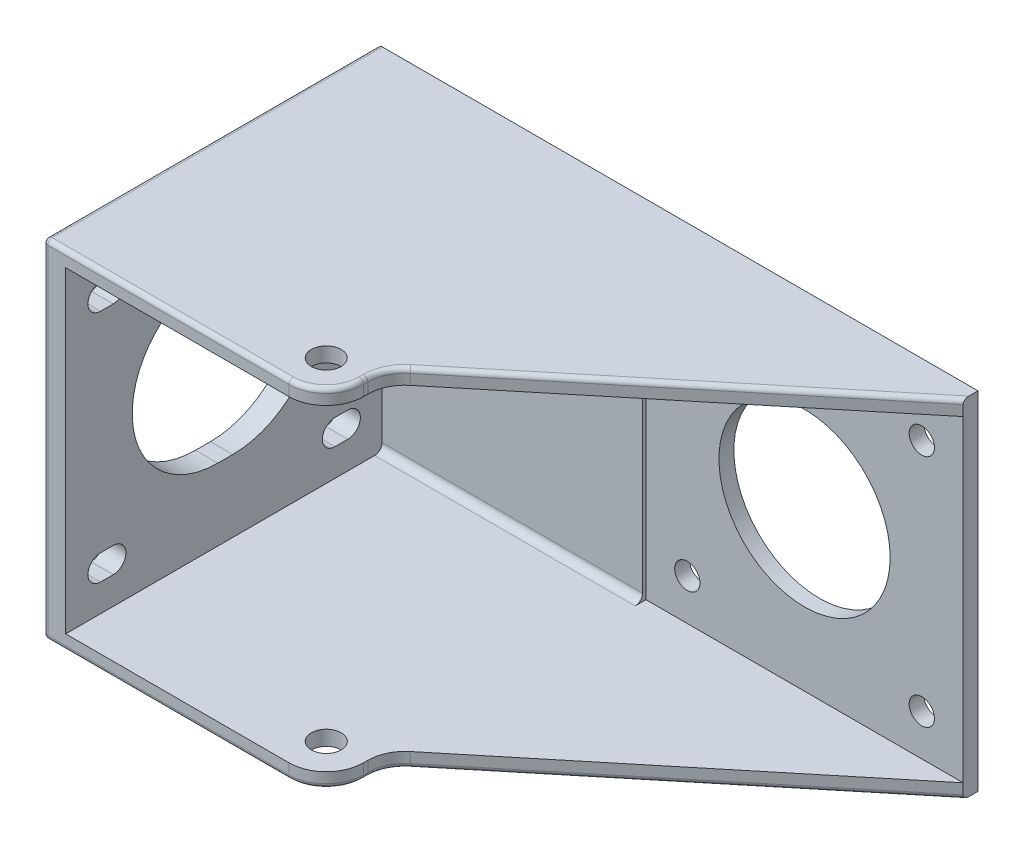
from build123d import *

# Parameters (mm, degrees)
SKETCH_1_W               = 42.6
SKETCH_1_H               = 42.6
SKETCH_1_R               = 1.7
SKETCH_1_R_2             = 11.5
EXTRUDE_1_DEPTH          = 2
SKETCH_2_W               = 37
SKETCH_2_H               = 42.6
EXTRUDE_2_DEPTH          = 2
EXTRUDE_3_DEPTH          = 2
EXTRUDE_4_DEPTH          = 2
BOSS_EXTRUDE1_DEPTH      = 36
BOSS_EXTRUDE1_DEPTH_BACK = 2
SKETCH1_W                = 44.957073211
SKETCH1_H                = 46.6
SKETCH4_W                = 35
SKETCH4_H                = 42.6
CUT_EXTRUDE2_DEPTH       = 42.5
CUT_EXTRUDE3_REACH       = 97.186
CUT_EXTRUDE4_REACH       = 79.978
SKETCH6_R                = 1.7
SKETCH7_R                = 3
CUT_EXTRUDE5_DEPTH       = 1.5
FILLET1_R                = 5
FILLET2_R                = 1
CHAMFER1_SIZE            = 1
FILLET3_R                = 0.6
SKETCH8_R                = 2
CUT_EXTRUDE6_DEPTH       = 88.801984213


with BuildPart() as part:
    # Эскиз1 → Бобышка-Вытянуть1 (new body)
    with BuildSketch(Plane.XY):
        Rectangle(SKETCH_1_W, SKETCH_1_H)
        with Locations((-15.75, 15.75)):
            Circle(SKETCH_1_R, mode=Mode.SUBTRACT)
        with Locations((15.75, 15.75)):
            Circle(SKETCH_1_R, mode=Mode.SUBTRACT)
        with Locations((15.75, -15.75)):
            Circle(SKETCH_1_R, mode=Mode.SUBTRACT)
        with Locations((-15.75, -15.75)):
            Circle(SKETCH_1_R, mode=Mode.SUBTRACT)
        Circle(SKETCH_1_R_2, mode=Mode.SUBTRACT)
    extrude(amount=EXTRUDE_1_DEPTH)

    # Эскиз2 → Бобышка-Вытянуть2 (add)
    with BuildSketch(Plane.ZY.offset(21.3)):
        with Locations((18.5, 0)):
            Rectangle(SKETCH_2_W, SKETCH_2_H)
    extrude(amount=EXTRUDE_2_DEPTH)

    # Эскиз3 → Бобышка-Вытянуть3 (add)
    with BuildSketch(Plane.XZ.offset(21.3)):
        Polygon((-23.3, 0), (-23.3, 37), (-21.3, 37), (21.3, 2), (21.3, 0), align=None)
    extrude(amount=EXTRUDE_3_DEPTH)

    # Эскиз4 → Бобышка-Вытянуть4 (add)
    with BuildSketch(Plane(origin=(0, 21.3, 0), x_dir=(1, 0, 0), z_dir=(0, 1, 0))):
        Polygon((-23.3, -37), (-23.3, 0), (21.3, 0), (21.3, -2), (-21.3, -37), align=None)
    extrude(amount=EXTRUDE_4_DEPTH)

    # Sketch1 → Boss-Extrude1 (add, two sides: drawn at the far end of the back side and taken through both)
    with BuildSketch(Plane.ZY.offset(23.3).offset(-BOSS_EXTRUDE1_DEPTH_BACK)):
        with Locations((22.478536606, 0)):
            Rectangle(SKETCH1_W, SKETCH1_H)
    extrude(amount=BOSS_EXTRUDE1_DEPTH + BOSS_EXTRUDE1_DEPTH_BACK)

    # Sketch4 → Cut-Extrude2 (cut)
    with BuildSketch(Plane.XY.offset(44.957073211)):
        with Locations((-38.8, 0)):
            Rectangle(SKETCH4_W, SKETCH4_H)
    extrude(amount=-CUT_EXTRUDE2_DEPTH, mode=Mode.SUBTRACT)

    # Sketch5 → Cut-Extrude3 (cut, up to next)
    with BuildSketch(Plane.ZY.offset(59.3), mode=Mode.PRIVATE) as cut_extrude3_sk1:
        with BuildLine():
            Line((38.570845355, -14.202343453), (40.270845355, -14.202343453))
            ThreePointArc((40.270845355, -14.202343453), (41.970845355, -15.902343453), (40.270845355, -17.602343453))
            Line((40.270845355, -17.602343453), (38.570845355, -17.602343453))
            ThreePointArc((38.570845355, -17.602343453), (36.870845355, -15.902343453), (38.570845355, -14.202343453))
        make_face()
    cut_extrude3_tool1 = extrude(cut_extrude3_sk1.sketch, amount=-CUT_EXTRUDE3_REACH, mode=Mode.PRIVATE) & part.part
    # Sketch5 → Cut-Extrude3 (cut, up to next)
    with BuildSketch(Plane.ZY.offset(59.3), mode=Mode.PRIVATE) as cut_extrude3_sk2:
        with BuildLine():
            Line((38.570845355, 13.897656547), (40.270845355, 13.897656547))
            ThreePointArc((40.270845355, 13.897656547), (41.970845355, 15.597656547), (40.270845355, 17.297656547))
            Line((40.270845355, 17.297656547), (38.570845355, 17.297656547))
            ThreePointArc((38.570845355, 17.297656547), (36.870845355, 15.597656547), (38.570845355, 13.897656547))
        make_face()
    cut_extrude3_tool2 = extrude(cut_extrude3_sk2.sketch, amount=-CUT_EXTRUDE3_REACH, mode=Mode.PRIVATE) & part.part
    # Sketch5 → Cut-Extrude3 (cut, up to next)
    with BuildSketch(Plane.ZY.offset(59.3), mode=Mode.PRIVATE) as cut_extrude3_sk3:
        with BuildLine():
            Line((7.070845355, 17.297656547), (8.770845355, 17.297656547))
            ThreePointArc((8.770845355, 17.297656547), (10.470845355, 15.597656547), (8.770845355, 13.897656547))
            Line((8.770845355, 13.897656547), (7.070845355, 13.897656547))
            ThreePointArc((7.070845355, 13.897656547), (5.370845355, 15.597656547), (7.070845355, 17.297656547))
        make_face()
    cut_extrude3_tool3 = extrude(cut_extrude3_sk3.sketch, amount=-CUT_EXTRUDE3_REACH, mode=Mode.PRIVATE) & part.part
    # Sketch5 → Cut-Extrude3 (cut, up to next)
    with BuildSketch(Plane.ZY.offset(59.3), mode=Mode.PRIVATE) as cut_extrude3_sk4:
        with BuildLine():
            Line((7.070845355, -14.202343453), (8.770845355, -14.202343453))
            ThreePointArc((8.770845355, -14.202343453), (10.470845355, -15.902343453), (8.770845355, -17.602343453))
            Line((8.770845355, -17.602343453), (7.070845355, -17.602343453))
            ThreePointArc((7.070845355, -17.602343453), (5.370845355, -15.902343453), (7.070845355, -14.202343453))
        make_face()
    cut_extrude3_tool4 = extrude(cut_extrude3_sk4.sketch, amount=-CUT_EXTRUDE3_REACH, mode=Mode.PRIVATE) & part.part
    # Sketch5 → Cut-Extrude3 (cut, up to next)
    with BuildSketch(Plane.ZY.offset(59.3), mode=Mode.PRIVATE) as cut_extrude3_sk5:
        with BuildLine():
            Line((22.520845355, 11.347656547), (24.520845355, 11.347656547))
            ThreePointArc((24.520845355, 11.347656547), (36.020845355, -0.152343453), (24.520845355, -11.652343453))
            Line((24.520845355, -11.652343453), (22.520845355, -11.652343453))
            ThreePointArc((22.520845355, -11.652343453), (11.020845355, -0.152343453), (22.520845355, 11.347656547))
        make_face()
    cut_extrude3_tool5 = extrude(cut_extrude3_sk5.sketch, amount=-CUT_EXTRUDE3_REACH, mode=Mode.PRIVATE) & part.part
    add(cut_extrude3_tool1.solids().sort_by_distance((-59.3, -15.902343, 39.420845))[0], mode=Mode.SUBTRACT)
    add(cut_extrude3_tool2.solids().sort_by_distance((-59.3, 15.597657, 39.420845))[0], mode=Mode.SUBTRACT)
    add(cut_extrude3_tool3.solids().sort_by_distance((-59.3, 15.597657, 7.920845))[0], mode=Mode.SUBTRACT)
    add(cut_extrude3_tool4.solids().sort_by_distance((-59.3, -15.902343, 7.920845))[0], mode=Mode.SUBTRACT)
    add(cut_extrude3_tool5.solids().sort_by_distance((-59.3, -0.152343, 23.520845))[0], mode=Mode.SUBTRACT)

    # Sketch6 → Cut-Extrude4 (cut, up to next)
    with BuildSketch(Plane(origin=(0, 0, 0), x_dir=(-1, 0, 0), z_dir=(0, 0, -1)), mode=Mode.PRIVATE) as cut_extrude4_sk1:
        with Locations((37.3, 0)):
            Circle(SKETCH6_R)
    cut_extrude4_tool1 = extrude(cut_extrude4_sk1.sketch, amount=-CUT_EXTRUDE4_REACH, mode=Mode.PRIVATE) & part.part
    add(cut_extrude4_tool1.solids().sort_by_distance((-37.3, 0, 0))[0], mode=Mode.SUBTRACT)

    # Sketch7 → Cut-Extrude5 (cut)
    with BuildSketch(Plane.XY.offset(2.457073211)):
        with Locations((-37.3, 0)):
            Circle(SKETCH7_R)
    extrude(amount=-CUT_EXTRUDE5_DEPTH, mode=Mode.SUBTRACT)

    # Fillet1
    fillet1_edges = [part.edges().sort_by_distance(p)[0] for p in [
        (-21.3, 22.3, 44.957073211),
        (-21.3, -22.3, 37),
        (-21.3, 22.3, 37),
        (-21.3, -22.3, 44.957073211),
    ]]
    fillet(fillet1_edges, radius=FILLET1_R)

    # Fillet2
    fillet2_edges = [part.edges().sort_by_distance(p)[0] for p in [
        (-38.8, -21.3, 2.457073211),
        (-38.8, 21.3, 2.457073211),
    ]]
    fillet(fillet2_edges, radius=FILLET2_R)

    # Chamfer1
    chamfer1_edges = [part.edges().sort_by_distance(p)[0] for p in [
        (-40.3, 0, 0.957073211),
    ]]
    chamfer(chamfer1_edges, length=CHAMFER1_SIZE)

    # Fillet3
    fillet3_edges = [part.edges().sort_by_distance(p)[0] for p in [
        (0.912958055, 23.3, 18.749917091),
        (-21.3, 23.3, 39.660110463),
        (-21.3, -23.3, 39.660110463),
        (-42.8, 23.3, 44.957073211),
        (-42.8, -23.3, 44.957073211),
        (-22.764466094, -23.3, 43.492607117),
        (-22.764466094, 23.3, 43.492607117),
        (-20.820532018, 23.3, 37.226610733),
        (-20.820532018, -23.3, 37.226610733),
        (0.912958055, -23.3, 18.749917091),
        (-59.3, -23.3, 22.478536605),
        (-59.3, 0, 44.957073211),
        (-59.3, 23.3, 22.478536605),
    ]]
    fillet(fillet3_edges, radius=FILLET3_R)

    # Sketch8 → Cut-Extrude6 (cut, through all)
    with BuildSketch(Plane.XZ.offset(23.3)):
        with Locations(Location((-26.3, 39.957073211, 0), (0, 0, 270))):
            Circle(SKETCH8_R)
    extrude(amount=-CUT_EXTRUDE6_DEPTH, mode=Mode.SUBTRACT)


solid = part.part
